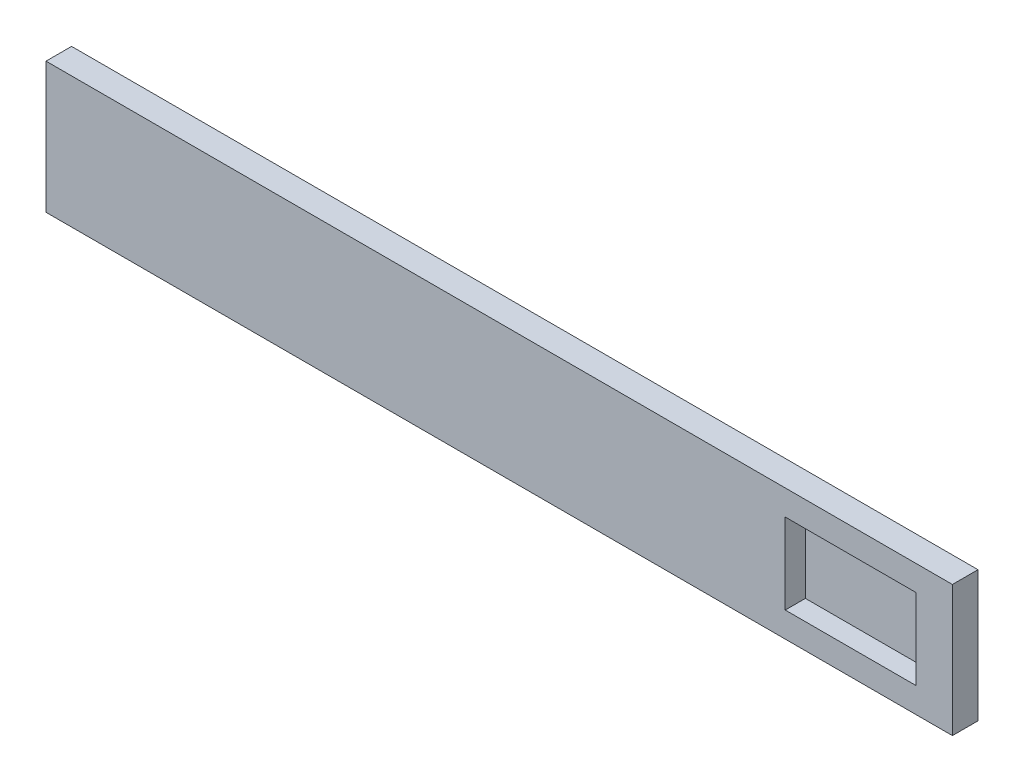
from build123d import *

# Parameters (mm, degrees)
SKETCH1_W           = 900
SKETCH1_H           = 130
BOSS_EXTRUDE1_DEPTH = 25.4
SKETCH3_W           = 130
SKETCH3_H           = 80
CUT_EXTRUDE3_DEPTH  = 20


with BuildPart() as part:
    # Sketch1 → Boss-Extrude1 (new body)
    with BuildSketch(Plane.XY):
        with Locations((450, 65)):
            Rectangle(SKETCH1_W, SKETCH1_H)
    extrude(amount=BOSS_EXTRUDE1_DEPTH)

    # Sketch3 → Cut-Extrude3 (cut)
    with BuildSketch(Plane.XY.offset(25.4)):
        with Locations((799, 65)):
            Rectangle(SKETCH3_W, SKETCH3_H)
    extrude(amount=-CUT_EXTRUDE3_DEPTH, mode=Mode.SUBTRACT)


solid = part.part
